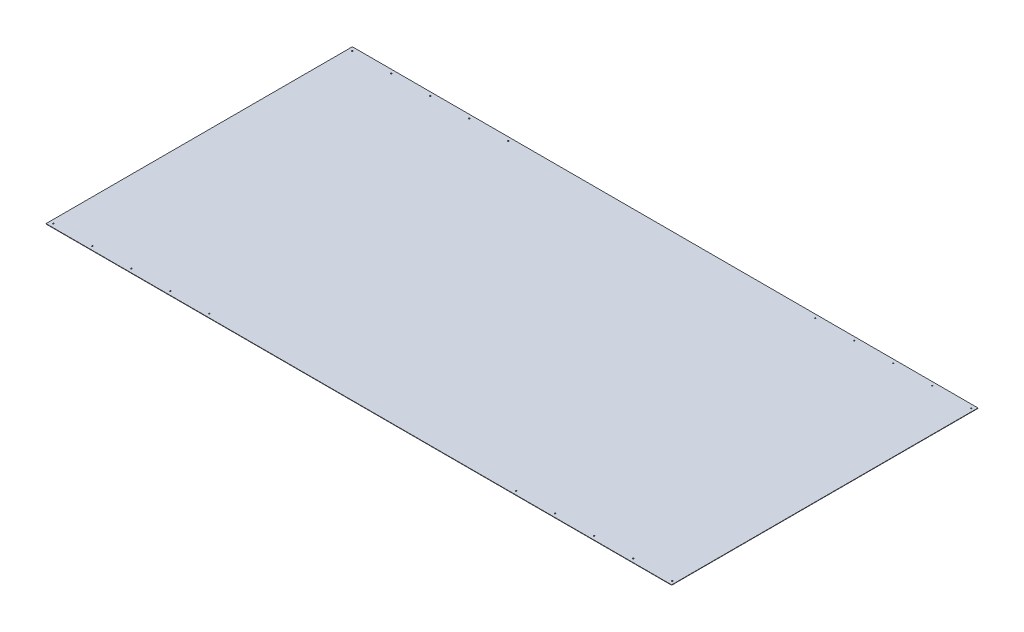
from build123d import *

# Parameters (mm, degrees)
SKETCH1_W           = 3408.5
SKETCH1_H           = 1669
BOSS_EXTRUDE1_DEPTH = 2
SKETCH3_R           = 3.25
CUT_EXTRUDE1_DEPTH  = 10


with BuildPart() as part:
    # Sketch1 → Boss-Extrude1 (new body)
    with BuildSketch(Plane(origin=(0, 0, 0), x_dir=(1, 0, 0), z_dir=(0, 1, 0))):
        Rectangle(SKETCH1_W, SKETCH1_H)
    extrude(amount=BOSS_EXTRUDE1_DEPTH)

    # Sketch3 → Cut-Extrude1 (cut)
    with BuildSketch(Plane(origin=(0, 2, 0), x_dir=(1, 0, 0), z_dir=(0, 1, 0))):
        with Locations(Location((-1684.25, 814.5, 0), (0, 0, 270))):
            Circle(SKETCH3_R)
        with Locations(Location((-1684.25, -814.5, 0), (0, 0, 270))):
            Circle(SKETCH3_R)
        with Locations(Location((-1471.75, 814.5, 0), (0, 0, 270))):
            Circle(SKETCH3_R)
        with Locations(Location((-1471.75, -814.5, 0), (0, 0, 270))):
            Circle(SKETCH3_R)
        with Locations(Location((-1259.25, 814.5, 0), (0, 0, 270))):
            Circle(SKETCH3_R)
        with Locations(Location((-1259.25, -814.5, 0), (0, 0, 270))):
            Circle(SKETCH3_R)
        with Locations(Location((-1046.75, 814.5, 0), (0, 0, 270))):
            Circle(SKETCH3_R)
        with Locations(Location((-1046.75, -814.5, 0), (0, 0, 270))):
            Circle(SKETCH3_R)
        with Locations(Location((-834.25, 814.5, 0), (0, 0, 270))):
            Circle(SKETCH3_R)
        with Locations(Location((-834.25, -814.5, 0), (0, 0, 270))):
            Circle(SKETCH3_R)
        with Locations(Location((1687.25, 814.5, 0), (0, 0, 270))):
            Circle(SKETCH3_R)
        with Locations(Location((1687.25, -814.5, 0), (0, 0, 270))):
            Circle(SKETCH3_R)
        with Locations(Location((1474.75, 814.5, 0), (0, 0, 270))):
            Circle(SKETCH3_R)
        with Locations(Location((1474.75, -814.5, 0), (0, 0, 270))):
            Circle(SKETCH3_R)
        with Locations(Location((1262.25, 814.5, 0), (0, 0, 270))):
            Circle(SKETCH3_R)
        with Locations(Location((1262.25, -814.5, 0), (0, 0, 270))):
            Circle(SKETCH3_R)
        with Locations(Location((1049.75, 814.5, 0), (0, 0, 270))):
            Circle(SKETCH3_R)
        with Locations(Location((1049.75, -814.5, 0), (0, 0, 270))):
            Circle(SKETCH3_R)
        with Locations(Location((837.25, 814.5, 0), (0, 0, 270))):
            Circle(SKETCH3_R)
        with Locations(Location((837.25, -814.5, 0), (0, 0, 270))):
            Circle(SKETCH3_R)
    extrude(amount=-CUT_EXTRUDE1_DEPTH, mode=Mode.SUBTRACT)


solid = part.part
